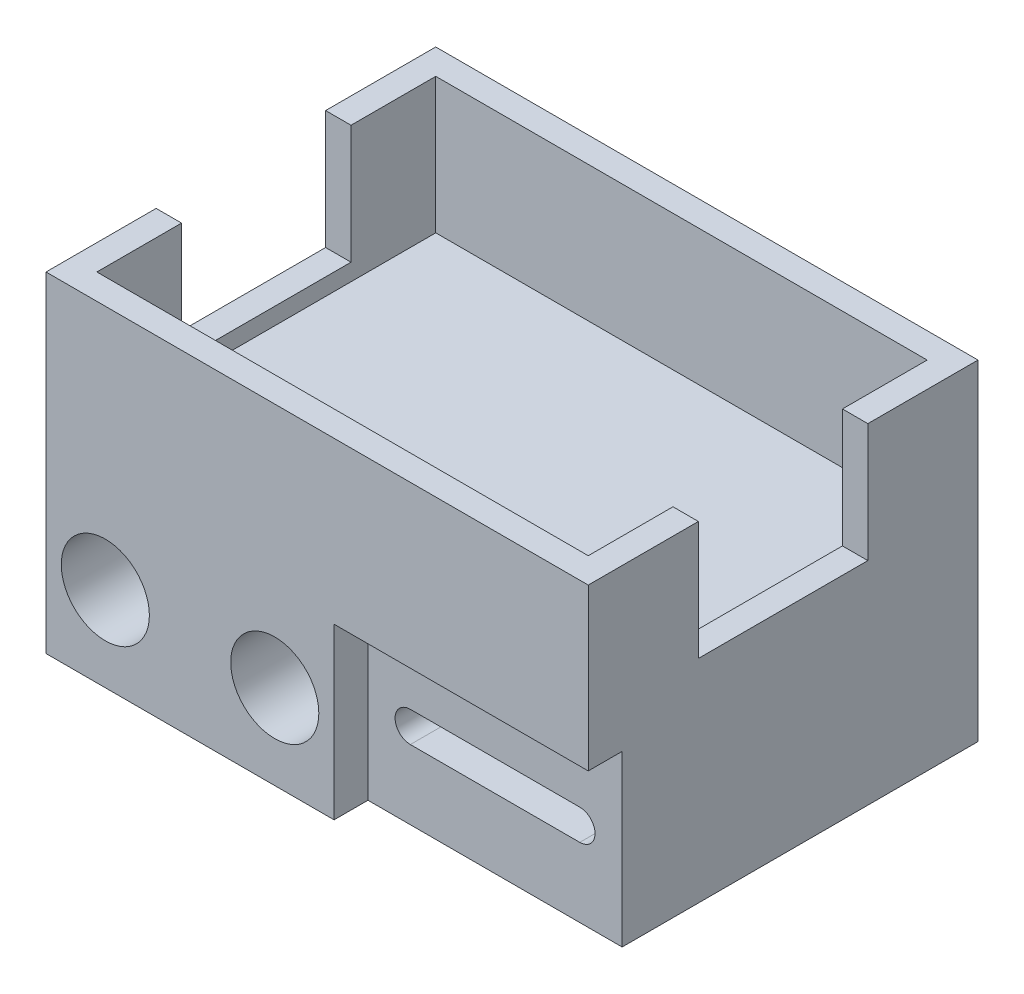
from build123d import *

# Parameters (mm, degrees)
SKETCH4_W           = 32
SKETCH4_H           = 23
BOSS_EXTRUDE3_DEPTH = 9.5
SKETCH5_W           = 29
SKETCH5_H           = 20
CUT_EXTRUDE2_DEPTH  = 8
SKETCH7_W           = 10
SKETCH7_H           = 7
CUT_EXTRUDE4_DEPTH  = 36.305806888
BOSS_EXTRUDE4_DEPTH = 10
CUT_EXTRUDE5_DEPTH  = 5
SKETCH10_W          = 14
SKETCH10_H          = 3
CUT_EXTRUDE6_DEPTH  = 7.9
CIRPATTERN1_COUNT   = 2
SKETCH11_R          = 2.6
CUT_EXTRUDE7_DEPTH  = 7
CIRPATTERN2_COUNT   = 2
CUT_EXTRUDE8_REACH  = 26.739
SKETCH12_R          = 1.7
CUT_EXTRUDE9_START  = -10
SKETCH13_R          = 1.7
CUT_EXTRUDE9_DEPTH  = 10


with BuildPart() as part:
    # Sketch4 → Boss-Extrude3 (new body)
    with BuildSketch(Plane(origin=(0, 0, 0), x_dir=(1, 0, 0), z_dir=(0, 1, 0))):
        Rectangle(SKETCH4_W, SKETCH4_H)
    extrude(amount=BOSS_EXTRUDE3_DEPTH)

    # Sketch5 → Cut-Extrude2 (cut)
    with BuildSketch(Plane(origin=(0, 9.5, 0), x_dir=(1, 0, 0), z_dir=(0, 1, 0))):
        Rectangle(SKETCH5_W, SKETCH5_H)
    extrude(amount=-CUT_EXTRUDE2_DEPTH, mode=Mode.SUBTRACT)

    # Sketch7 → Cut-Extrude4 (cut, through all)
    with BuildSketch(Plane(origin=(16, 0, 0), x_dir=(0, 0, -1), z_dir=(1, 0, 0))):
        with Locations((0, 6)):
            Rectangle(SKETCH7_W, SKETCH7_H)
    extrude(amount=-CUT_EXTRUDE4_DEPTH, mode=Mode.SUBTRACT)

    # Sketch8 → Boss-Extrude4 (add)
    with BuildSketch(Plane(origin=(0, 0, 0), x_dir=(-1, 0, 0), z_dir=(0, -1, 0))):
        Polygon((-16, -9.5), (-1, -9.5), (-1, -11.5), (16, -11.5), (16, 9.5), (1, 9.5), (1, 11.5), (-16, 11.5), align=None)
    extrude(amount=BOSS_EXTRUDE4_DEPTH)

    # Sketch9 → Cut-Extrude5 (cut)
    with BuildSketch(Plane(origin=(0, 0, -9.5), x_dir=(-1, 0, 0), z_dir=(0, 0, -1))):
        with BuildLine():
            Line((3.5, -4.1), (13.5, -4.1))
            ThreePointArc((13.5, -4.1), (14.4, -5), (13.5, -5.9))
            Line((13.5, -5.9), (3.5, -5.9))
            ThreePointArc((3.5, -5.9), (2.6, -5), (3.5, -4.1))
        make_face()
    cut_extrude5 = extrude(amount=-CUT_EXTRUDE5_DEPTH, mode=Mode.SUBTRACT)

    # Sketch10 → Cut-Extrude6 (cut)
    with BuildSketch(Plane(origin=(0, -10, 0), x_dir=(-1, 0, 0), z_dir=(0, -1, 0))):
        with Locations((-8, -4)):
            Rectangle(SKETCH10_W, SKETCH10_H)
        with Locations((8, 4)):
            Rectangle(SKETCH10_W, SKETCH10_H)
    extrude(amount=-CUT_EXTRUDE6_DEPTH, mode=Mode.SUBTRACT)

    # CirPattern1: Cut-Extrude5 ×2 about axis
    cirpattern1_axis = Axis((0, 0, 0), (0, -1, 0))
    for i in range(1, CIRPATTERN1_COUNT):
        add(cut_extrude5.rotate(cirpattern1_axis, i * 360 / CIRPATTERN1_COUNT), mode=Mode.SUBTRACT)

    # Sketch11 → Cut-Extrude7 (cut)
    with BuildSketch(Plane(origin=(0, 0, -11.5), x_dir=(-1, 0, 0), z_dir=(0, 0, -1))):
        with Locations((-12.5, -5)):
            Circle(SKETCH11_R)
        with Locations((-2.5, -5)):
            Circle(SKETCH11_R)
    cut_extrude7 = extrude(amount=-CUT_EXTRUDE7_DEPTH, mode=Mode.SUBTRACT)

    # CirPattern2: Cut-Extrude7 ×2 about axis
    cirpattern2_axis = Axis((0, 0, 0), (0, -1, 0))
    for i in range(1, CIRPATTERN2_COUNT):
        add(cut_extrude7.rotate(cirpattern2_axis, i * 360 / CIRPATTERN2_COUNT), mode=Mode.SUBTRACT)

    # Cut-Extrude8: up to this face of the body (flat: up to its plane)
    cut_extrude8_end = Plane(part.part.faces().sort_by_distance((-7.885932934, -6.28954084, -5.5))[0])
    # Sketch12 → Cut-Extrude8 (cut, up to the picked face)
    with BuildSketch(Plane.XY.offset(4.5), mode=Mode.PRIVATE) as cut_extrude8_sk1:
        with Locations((-2.5, -5)):
            Circle(SKETCH12_R)
    cut_extrude8_tool1 = split(extrude(cut_extrude8_sk1.sketch, amount=-CUT_EXTRUDE8_REACH, mode=Mode.PRIVATE), bisect_by=cut_extrude8_end, keep=Keep.BOTH, mode=Mode.PRIVATE)
    # Sketch12 → Cut-Extrude8 (cut, up to the picked face)
    with BuildSketch(Plane.XY.offset(4.5), mode=Mode.PRIVATE) as cut_extrude8_sk2:
        with Locations((-12.5, -5)):
            Circle(SKETCH12_R)
    cut_extrude8_tool2 = split(extrude(cut_extrude8_sk2.sketch, amount=-CUT_EXTRUDE8_REACH, mode=Mode.PRIVATE), bisect_by=cut_extrude8_end, keep=Keep.BOTH, mode=Mode.PRIVATE)
    add(cut_extrude8_tool1.solids().sort_by(Axis((-2.5, -5, 4.5), (0, 0, -1)))[0], mode=Mode.SUBTRACT)
    add(cut_extrude8_tool2.solids().sort_by(Axis((-12.5, -5, 4.5), (0, 0, -1)))[0], mode=Mode.SUBTRACT)

    # Sketch13 → Cut-Extrude9 (cut)
    with BuildSketch(Plane(origin=(0, 0, -4.5), x_dir=(-1, 0, 0), z_dir=(0, 0, -1)).offset(CUT_EXTRUDE9_START)):
        with Locations((-12.5, -5)):
            Circle(SKETCH13_R)
        with Locations((-2.5, -5)):
            Circle(SKETCH13_R)
    extrude(amount=CUT_EXTRUDE9_DEPTH, mode=Mode.SUBTRACT)


solid = part.part
